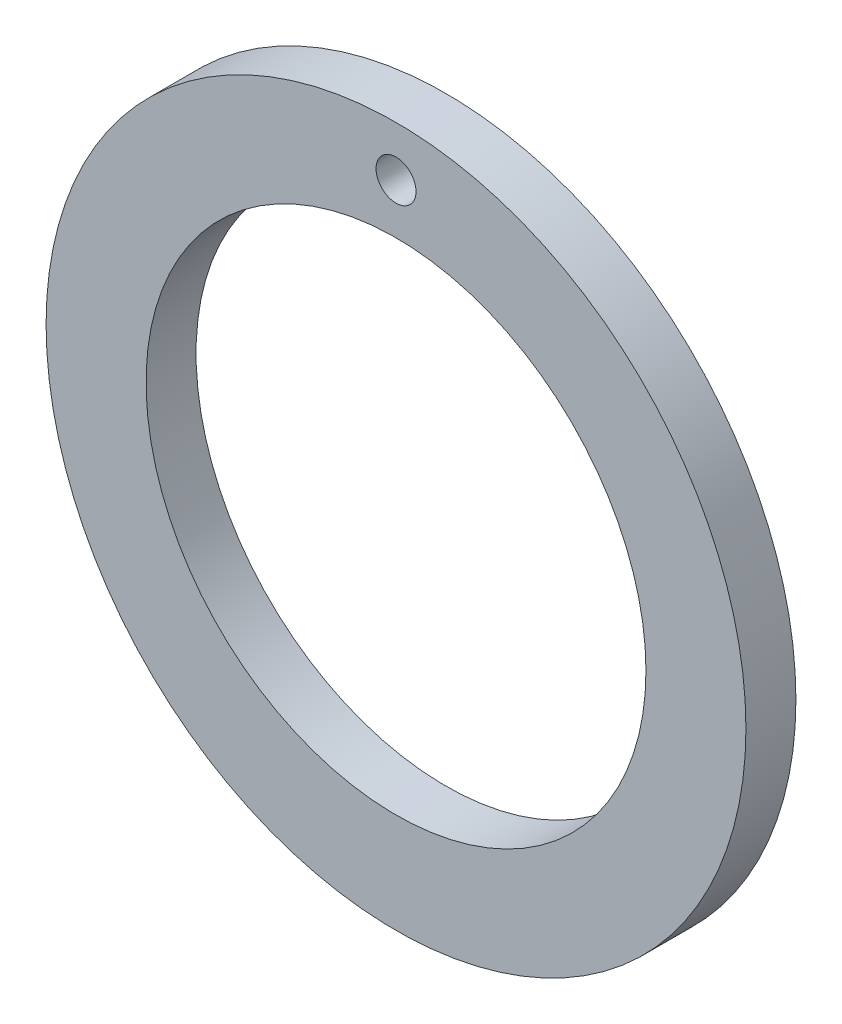
from build123d import *

# Parameters (mm, degrees)
SKETCH3_R           = 11.1125
SKETCH3_R_2         = 7.9375
SKETCH3_R_3         = 0.635
BOSS_EXTRUDE1_DEPTH = 0.79375


with BuildPart() as part:
    # Sketch3 → Boss-Extrude1 (new, symmetric)
    with BuildSketch(Plane.XY):
        Circle(SKETCH3_R)
        Circle(SKETCH3_R_2, mode=Mode.SUBTRACT)
        with Locations((0, 9.525)):
            Circle(SKETCH3_R_3, mode=Mode.SUBTRACT)
    extrude(amount=BOSS_EXTRUDE1_DEPTH, both=True)


solid = part.part
